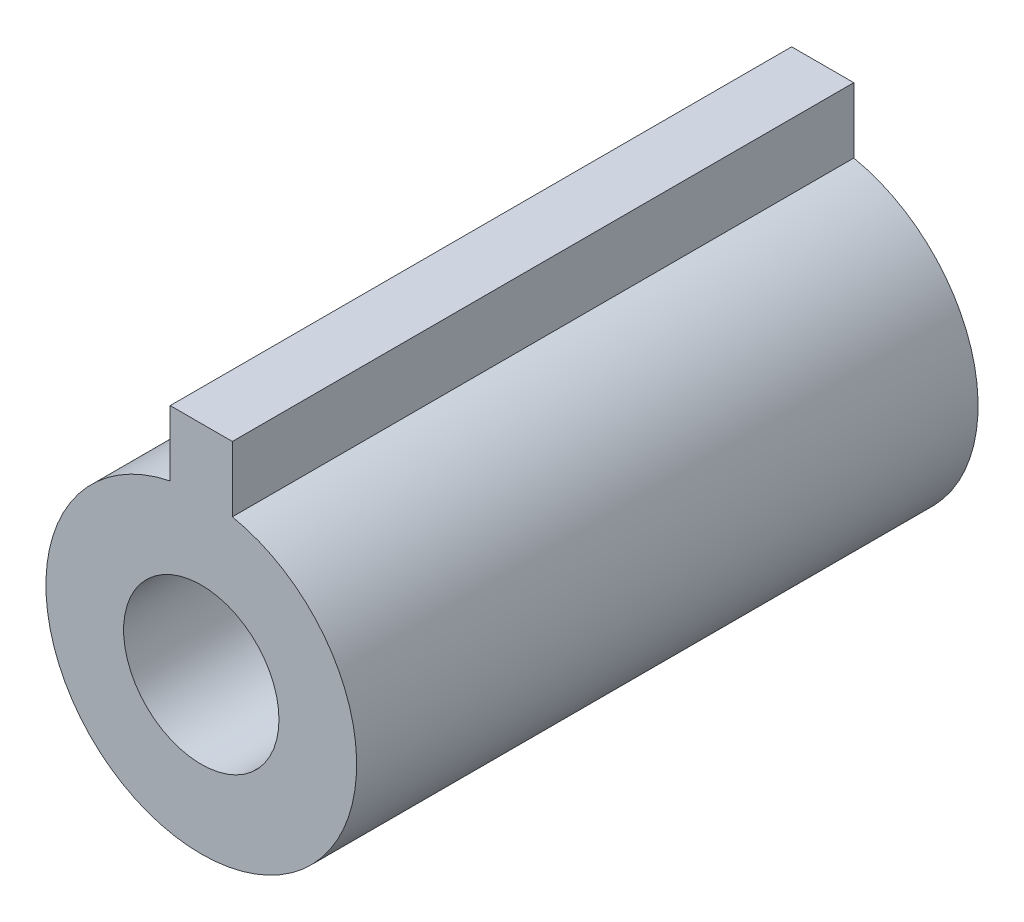
from build123d import *

# Parameters (mm, degrees)
SKETCH2_R           = 2.5
BOSS_EXTRUDE1_DEPTH = 20


with BuildPart() as part:
    # Sketch2 → Boss-Extrude1 (new body)
    with BuildSketch(Plane.XY):
        with BuildLine():
            Line((1, 4.898979486), (1, 7))
            Line((1, 7), (-1, 7))
            Line((-1, 7), (-1, 4.898979486))
            ThreePointArc((-1, 4.898979486), (0, -5), (1, 4.898979486))
        make_face()
        Circle(SKETCH2_R, mode=Mode.SUBTRACT)
    extrude(amount=BOSS_EXTRUDE1_DEPTH)


solid = part.part
